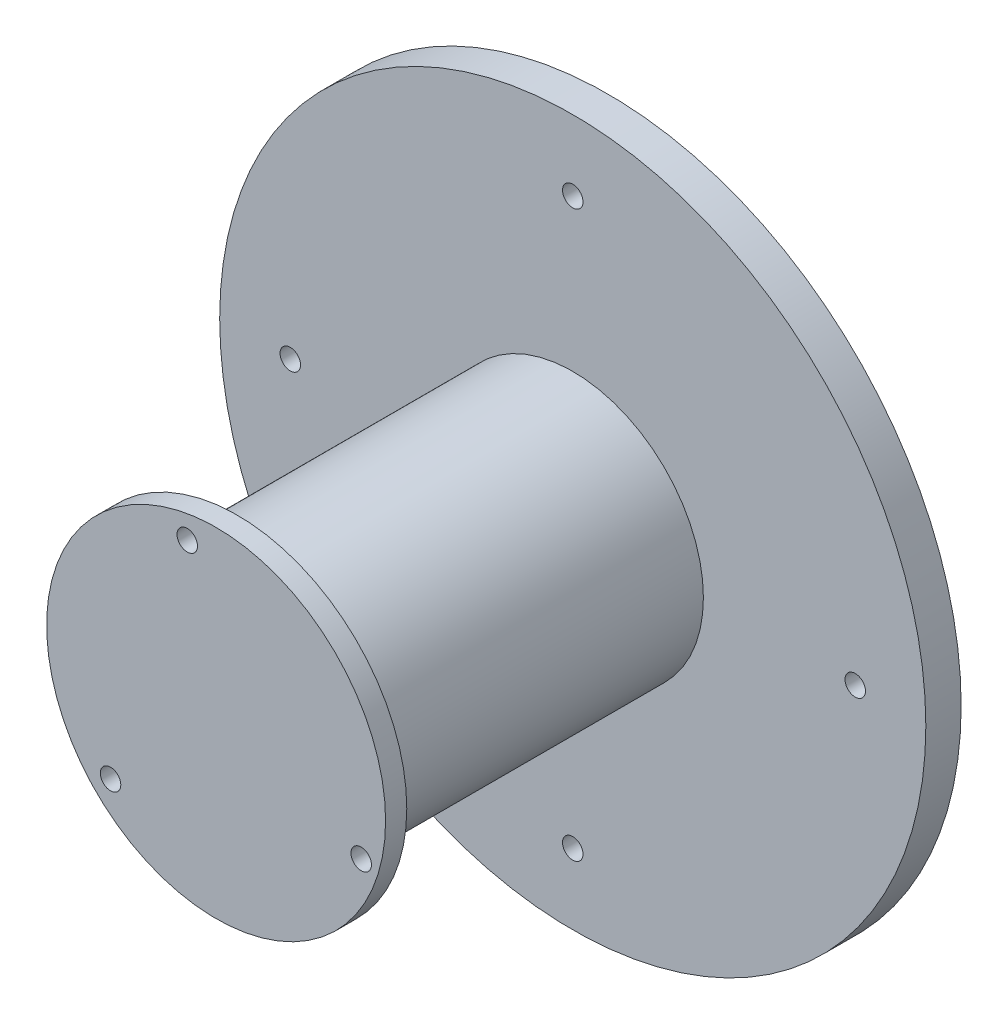
from build123d import *

# Parameters (mm, degrees)
SKETCH_1_R                     = 18.5
EXTRUDE_1_DEPTH                = 50
SKETCH_2_R                     = 50
EXTRUDE_2_DEPTH                = 5
SKETCH_3_R                     = 25
SKETCH_3_R_2                   = 23
EXTRUDE_3_DEPTH                = 3
SKETCH_4_R                     = 1.45
CUT_EXTRUDE_1_DEPTH            = 23
SKETCH_5_R                     = 24
EXTRUDE_4_DEPTH                = 3
HOLE_WIZARD_M3_5_3_D           = 2.9
HOLE_WIZARD_M3_5_3_DEPTH       = 10
HOLE_WIZARD_M3_5_3_CSINK_D     = 3.55
HOLE_WIZARD_M3_5_3_CSINK_ANGLE = 90
HOLE_WIZARD_M3_5_3_TIP         = 0.871247898


with BuildPart() as part:
    # 스케치1 → 보스-돌출1 (new body)
    with BuildSketch(Plane.XY):
        Circle(SKETCH_1_R)
    extrude(amount=EXTRUDE_1_DEPTH)

    # 스케치2 → 보스-돌출2 (add)
    with BuildSketch(Plane(origin=(0, 0, 0), x_dir=(-1, 0, 0), z_dir=(0, 0, -1))):
        Circle(SKETCH_2_R)
    extrude(amount=EXTRUDE_2_DEPTH)

    # 스케치3 → 보스-돌출3 (add)
    with BuildSketch(Plane(origin=(0, 0, -5), x_dir=(-1, 0, 0), z_dir=(0, 0, -1))):
        Circle(SKETCH_3_R)
        Circle(SKETCH_3_R_2, mode=Mode.SUBTRACT)
    extrude(amount=EXTRUDE_3_DEPTH)

    # 스케치4 → 컷-돌출1 (cut)
    with BuildSketch(Plane(origin=(0, 0, -5), x_dir=(-1, 0, 0), z_dir=(0, 0, -1))):
        with Locations((-40, 0)):
            Circle(SKETCH_4_R)
        with Locations((0, 40)):
            Circle(SKETCH_4_R)
        with Locations((40, 0)):
            Circle(SKETCH_4_R)
        with Locations((0, -40)):
            Circle(SKETCH_4_R)
    extrude(amount=-CUT_EXTRUDE_1_DEPTH, mode=Mode.SUBTRACT)

    # 스케치5 → 보스-돌출4 (add)
    with BuildSketch(Plane.XY.offset(50)):
        with Locations((-0.504488898, 0.115254903)):
            Circle(SKETCH_5_R)
    extrude(amount=-EXTRUDE_4_DEPTH)

    # M3.5 나사 구멍3
    with Locations(Plane(origin=(0, 0, 47), x_dir=(-1, 0, 0), z_dir=(0, 0, -1))):
        with Locations((4.588537545, 20.492567511), (15.452815281, -14.220073836), (-20.041352826, -6.272493675)):
            CounterSinkHole(HOLE_WIZARD_M3_5_3_D / 2, HOLE_WIZARD_M3_5_3_CSINK_D / 2, depth=HOLE_WIZARD_M3_5_3_DEPTH, counter_sink_angle=HOLE_WIZARD_M3_5_3_CSINK_ANGLE)
            with Locations((0, 0, -(HOLE_WIZARD_M3_5_3_DEPTH + HOLE_WIZARD_M3_5_3_TIP / 2))):  # 118° drill point
                Cone(0, HOLE_WIZARD_M3_5_3_D / 2, HOLE_WIZARD_M3_5_3_TIP, mode=Mode.SUBTRACT)


solid = part.part
